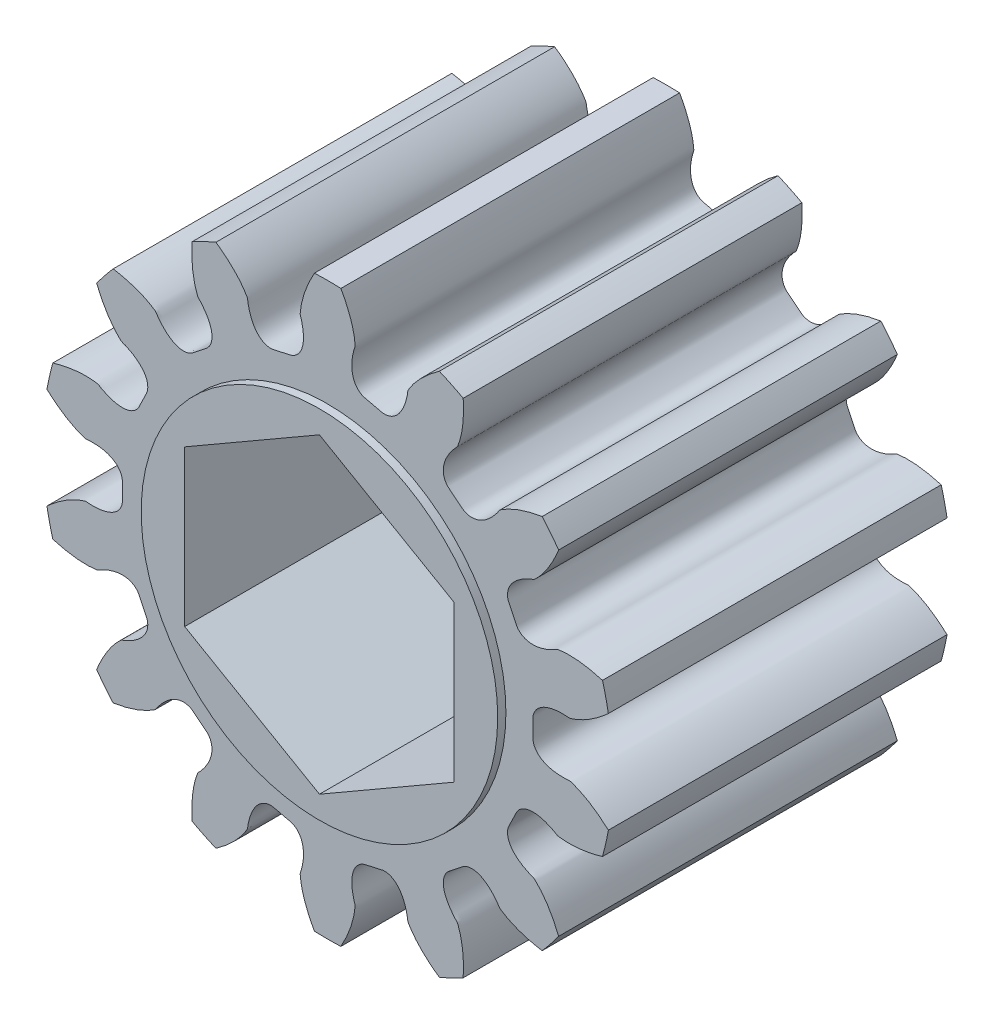
from build123d import *

# Parameters (mm, degrees)
BOSS_EXTRUDE1_DEPTH = 12.065
SKETCH2_R           = 6.35
BOSS_EXTRUDE2_DEPTH = 0.2921
BOSS_EXTRUDE3_START = 0.2921
SKETCH3_R           = 6.35
BOSS_EXTRUDE3_DEPTH = 0.2921
CUT_EXTRUDE1_DEPTH  = 20.058275239


with BuildPart() as part:
    # Sketch1 → Boss-Extrude1 (new body)
    with BuildSketch(Plane.XY.offset(6.0325)):
        with BuildLine():
            ThreePointArc((8.228776346, 5.959265042), (7.943407862, 6.334656387), (7.640928824, 6.69640252))
            add(Edge.make_bspline(
                [(4.82824311, 8.939444528), (4.833892588, 8.852687386), (4.83956114, 8.714236491), (4.839397518, 8.527056628), (4.834597301, 8.381215605), (4.825704165, 8.244427954), (4.813292608, 8.116797302), (4.797939964, 7.998399272), (4.780222678, 7.889283272), (4.760723014, 7.789466905), (4.740002099, 7.698954413), (4.718682579, 7.617677092), (4.697178715, 7.545684876), (4.676542333, 7.482543191), (4.650701206, 7.415927439), (4.621669261, 7.324730091), (4.540040809, 7.261231409), (4.481952223, 7.188233595), (4.43551344, 7.130936279), (4.39285588, 7.073433212), (4.35314075, 7.016307214), (4.316544651, 6.959436941), (4.282987183, 6.902864935), (4.252459951, 6.846571912), (4.224945594, 6.790531236), (4.200443436, 6.734690952), (4.178969629, 6.678974044), (4.160566483, 6.623273893), (4.145313008, 6.567451505), (4.133339922, 6.5113341), (4.12484958, 6.454717507), (4.120141721, 6.397375872), (4.119644468, 6.339084418), (4.123947256, 6.279663842), (4.133825193, 6.219056118), (4.150237388, 6.157442121), (4.174255479, 6.095387744), (4.206926479, 6.034019633), (4.248882322, 5.975011401), (4.295645816, 5.925851012), (4.399067692, 5.839116758), (4.564695196, 5.723946729), (4.713833258, 5.588099595), (4.821406436, 5.506570908), (4.879740128, 5.471919088), (4.946604954, 5.444145733), (5.01370442, 5.425949552), (5.079547492, 5.416342044), (5.143268754, 5.41405174), (5.204554963, 5.417907952), (5.263443202, 5.426935365), (5.320162519, 5.44039122), (5.375018882, 5.457740758), (5.4283267, 5.478616606), (5.480372862, 5.502776799), (5.531401448, 5.530069487), (5.581609996, 5.560405678), (5.631151593, 5.593739269), (5.680139601, 5.63005274), (5.7286527, 5.669347478), (5.776741391, 5.711635705), (5.82442778, 5.756940272), (5.871728798, 5.805273657), (5.918585081, 5.856704777), (5.965154226, 5.911088458), (6.010681377, 5.969112777), (6.068923056, 6.041988502), (6.112665655, 6.135700144), (6.195116279, 6.184297517), (6.254311643, 6.224314153), (6.311278208, 6.258483483), (6.376680368, 6.295467976), (6.451175858, 6.334338877), (6.534808176, 6.374681199), (6.627782855, 6.415903197), (6.730220622, 6.457456868), (6.842233881, 6.498770629), (6.963902735, 6.539271495), (7.095281925, 6.578379777), (7.23639826, 6.615512324), (7.418848724, 6.657323281), (7.555089737, 6.682605074), (7.640928824, 6.69640252)],
                knots=[0.010313213, 0.010313213, 0.010313213, 0.010313213, 0.046086444, 0.067310464, 0.087321683, 0.106120101, 0.123705718, 0.140078533, 0.155238548, 0.169185761, 0.181920174, 0.193441785, 0.203750595, 0.212846604, 0.220729812, 0.233281794, 0.251264484, 0.261666579, 0.271771633, 0.281588016, 0.291125391, 0.300394957, 0.309409753, 0.318185016, 0.32673863, 0.335091659, 0.343268986, 0.351300066, 0.359219801, 0.367069473, 0.374897695, 0.382761153, 0.390724829, 0.398861066, 0.407246569, 0.415956082, 0.425051594, 0.434566975, 0.44449066, 0.454752968, 0.462386324, 0.5, 0.537613676, 0.545247032, 0.55550934, 0.565433025, 0.574948406, 0.584043918, 0.592753431, 0.601138934, 0.609275171, 0.617238847, 0.625102305, 0.632930527, 0.640780199, 0.648699934, 0.656731014, 0.664908341, 0.67326137, 0.681814984, 0.690590247, 0.699605043, 0.708874609, 0.718411984, 0.728228367, 0.738333421, 0.748735516, 0.766718206, 0.779270188, 0.787153396, 0.796249405, 0.806558215, 0.818079826, 0.830814239, 0.844761452, 0.859921467, 0.876294282, 0.893879899, 0.912678317, 0.932689536, 0.953913556, 0.989686787, 0.989686787, 0.989686787, 0.989686787], degree=3))
            ThreePointArc((4.82824311, 8.939444528), (4.408258789, 9.153843698), (3.978778828, 9.348524966))
            add(Edge.make_bspline(
                [(0.471417111, 10.14905739), (0.514149629, 10.073343122), (0.579328409, 9.951062669), (0.66039529, 9.782348447), (0.719348491, 9.648867489), (0.770685991, 9.521767488), (0.814880429, 9.40139107), (0.852419155, 9.288056869), (0.883800089, 9.182059508), (0.909540197, 9.083667481), (0.930143197, 8.993128076), (0.946199881, 8.910649547), (0.958061821, 8.836456624), (0.966865234, 8.770614142), (0.972486674, 8.699383378), (0.985898842, 8.604620918), (0.939905194, 8.511993324), (0.919241751, 8.421020874), (0.902262226, 8.349248743), (0.888778739, 8.278931848), (0.877782684, 8.210231353), (0.869485825, 8.143114555), (0.863797265, 8.077584899), (0.860717807, 8.013621369), (0.860243365, 7.951192432), (0.862395875, 7.890250987), (0.867223304, 7.830734652), (0.874810032, 7.772565723), (0.885287552, 7.715653255), (0.898848604, 7.659898293), (0.91576409, 7.605204685), (0.936402058, 7.551498993), (0.961245763, 7.498764457), (0.990904063, 7.447095278), (1.026100482, 7.396775482), (1.06762067, 7.348384173), (1.116184607, 7.30289617), (1.172246787, 7.261780829), (1.235650407, 7.226820207), (1.299112753, 7.202818146), (1.429925226, 7.169546354), (1.629120853, 7.137644824), (1.822431467, 7.079959365), (1.954725523, 7.053178809), (2.022317225, 7.047268639), (2.094610758, 7.051257271), (2.162960315, 7.063976446), (2.226451415, 7.083888618), (2.284856014, 7.109472745), (2.338399833, 7.139538162), (2.387539455, 7.173222229), (2.432803517, 7.209955125), (2.47469971, 7.249387802), (2.513670703, 7.291325687), (2.55007996, 7.335675252), (2.584213274, 7.382405588), (2.616287232, 7.431522224), (2.646459766, 7.483050046), (2.674840612, 7.537022452), (2.701500055, 7.593474833), (2.726478295, 7.652440109), (2.749785332, 7.713948463), (2.771431007, 7.778018481), (2.791331932, 7.844686497), (2.809693087, 7.913890096), (2.825535825, 7.985921691), (2.846390172, 8.076850568), (2.845140934, 8.180261043), (2.89834077, 8.259819748), (2.934311383, 8.321557397), (2.970810967, 8.377059766), (3.013689307, 8.438758577), (3.063941972, 8.50610243), (3.12178821, 8.578736309), (3.187669946, 8.656216247), (3.261933723, 8.738100893), (3.344928813, 8.823924037), (3.436975996, 8.913204193), (3.538376109, 9.005442832), (3.649406325, 9.100126183), (3.795647418, 9.216958844), (3.90742697, 9.298849712), (3.978778828, 9.348524966)],
                knots=[0.010313213, 0.010313213, 0.010313213, 0.010313213, 0.046086444, 0.067310464, 0.087321683, 0.106120101, 0.123705718, 0.140078533, 0.155238548, 0.169185761, 0.181920174, 0.193441785, 0.203750595, 0.212846604, 0.220729812, 0.233281794, 0.251264484, 0.261666579, 0.271771633, 0.281588016, 0.291125391, 0.300394957, 0.309409753, 0.318185016, 0.32673863, 0.335091659, 0.343268986, 0.351300066, 0.359219801, 0.367069473, 0.374897695, 0.382761153, 0.390724829, 0.398861066, 0.407246569, 0.415956082, 0.425051594, 0.434566975, 0.44449066, 0.454752968, 0.462386324, 0.5, 0.537613676, 0.545247032, 0.55550934, 0.565433025, 0.574948406, 0.584043918, 0.592753431, 0.601138934, 0.609275171, 0.617238847, 0.625102305, 0.632930527, 0.640780199, 0.648699934, 0.656731014, 0.664908341, 0.67326137, 0.681814984, 0.690590247, 0.699605043, 0.708874609, 0.718411984, 0.728228367, 0.738333421, 0.748735516, 0.766718206, 0.779270188, 0.787153396, 0.796249405, 0.806558215, 0.818079826, 0.830814239, 0.844761452, 0.859921467, 0.876294282, 0.893879899, 0.912678317, 0.932689536, 0.953913556, 0.989686787, 0.989686787, 0.989686787, 0.989686787], degree=3))
            ThreePointArc((0.471417111, 10.14905739), (0, 10.16), (-0.471417111, 10.14905739))
            add(Edge.make_bspline(
                [(-3.978778828, 9.348524966), (-3.90742697, 9.298849712), (-3.795647418, 9.216958844), (-3.649406325, 9.100126183), (-3.538376109, 9.005442832), (-3.436975996, 8.913204193), (-3.344928813, 8.823924037), (-3.261933723, 8.738100893), (-3.187669946, 8.656216247), (-3.12178821, 8.578736309), (-3.063941972, 8.50610243), (-3.013689307, 8.438758577), (-2.970810967, 8.377059766), (-2.934311383, 8.321557397), (-2.89834077, 8.259819748), (-2.845140934, 8.180261043), (-2.846390172, 8.076850568), (-2.825535825, 7.985921691), (-2.809693087, 7.913890096), (-2.791331932, 7.844686497), (-2.771431007, 7.778018481), (-2.749785332, 7.713948463), (-2.726478295, 7.652440109), (-2.701500055, 7.593474833), (-2.674840612, 7.537022452), (-2.646459766, 7.483050046), (-2.616287232, 7.431522224), (-2.584213274, 7.382405588), (-2.55007996, 7.335675252), (-2.513670703, 7.291325687), (-2.47469971, 7.249387802), (-2.432803517, 7.209955125), (-2.387539455, 7.173222229), (-2.338399833, 7.139538162), (-2.284856014, 7.109472745), (-2.226451415, 7.083888618), (-2.162960315, 7.063976446), (-2.094610758, 7.051257271), (-2.022317225, 7.047268639), (-1.954725523, 7.053178809), (-1.822431467, 7.079959365), (-1.629120854, 7.137644824), (-1.429925226, 7.169546354), (-1.299112753, 7.202818146), (-1.235650407, 7.226820207), (-1.172246787, 7.261780829), (-1.116184607, 7.30289617), (-1.06762067, 7.348384173), (-1.026100482, 7.396775482), (-0.990904063, 7.447095278), (-0.961245763, 7.498764457), (-0.936402058, 7.551498993), (-0.91576409, 7.605204685), (-0.898848604, 7.659898293), (-0.885287552, 7.715653255), (-0.874810032, 7.772565723), (-0.867223304, 7.830734652), (-0.862395875, 7.890250987), (-0.860243365, 7.951192432), (-0.860717807, 8.013621369), (-0.863797265, 8.077584899), (-0.869485825, 8.143114555), (-0.877782684, 8.210231353), (-0.888778739, 8.278931848), (-0.902262226, 8.349248743), (-0.919241751, 8.421020874), (-0.939905194, 8.511993324), (-0.985898842, 8.604620918), (-0.972486674, 8.699383378), (-0.966865234, 8.770614142), (-0.958061821, 8.836456624), (-0.946199881, 8.910649547), (-0.930143197, 8.993128076), (-0.909540197, 9.083667481), (-0.883800089, 9.182059508), (-0.852419155, 9.288056869), (-0.814880429, 9.40139107), (-0.770685991, 9.521767488), (-0.719348492, 9.648867489), (-0.66039529, 9.782348447), (-0.579328409, 9.951062669), (-0.514149629, 10.073343122), (-0.471417111, 10.14905739)],
                knots=[0.010313213, 0.010313213, 0.010313213, 0.010313213, 0.046086444, 0.067310464, 0.087321683, 0.106120101, 0.123705718, 0.140078533, 0.155238548, 0.169185761, 0.181920174, 0.193441785, 0.203750595, 0.212846604, 0.220729812, 0.233281794, 0.251264484, 0.261666579, 0.271771633, 0.281588016, 0.291125391, 0.300394957, 0.309409753, 0.318185016, 0.32673863, 0.335091659, 0.343268986, 0.351300066, 0.359219801, 0.367069473, 0.374897695, 0.382761153, 0.390724829, 0.398861066, 0.407246569, 0.415956082, 0.425051594, 0.434566975, 0.44449066, 0.454752968, 0.462386324, 0.5, 0.537613676, 0.545247032, 0.55550934, 0.565433025, 0.574948406, 0.584043918, 0.592753431, 0.601138934, 0.609275171, 0.617238847, 0.625102305, 0.632930527, 0.640780199, 0.648699934, 0.656731014, 0.664908341, 0.67326137, 0.681814984, 0.690590247, 0.699605043, 0.708874609, 0.718411984, 0.728228367, 0.738333421, 0.748735516, 0.766718206, 0.779270188, 0.787153396, 0.796249405, 0.806558215, 0.818079826, 0.830814239, 0.844761452, 0.859921467, 0.876294282, 0.893879899, 0.912678317, 0.932689536, 0.953913556, 0.989686787, 0.989686787, 0.989686787, 0.989686787], degree=3))
            ThreePointArc((-3.978778828, 9.348524966), (-4.408258789, 9.153843698), (-4.82824311, 8.939444528))
            add(Edge.make_bspline(
                [(-7.640928824, 6.69640252), (-7.555089737, 6.682605074), (-7.418848724, 6.657323281), (-7.23639826, 6.615512324), (-7.095281925, 6.578379777), (-6.963902735, 6.539271495), (-6.842233881, 6.498770629), (-6.730220622, 6.457456868), (-6.627782855, 6.415903197), (-6.534808176, 6.374681199), (-6.451175858, 6.334338877), (-6.376680368, 6.295467976), (-6.311278208, 6.258483483), (-6.254311643, 6.224314153), (-6.195116279, 6.184297517), (-6.112665655, 6.135700144), (-6.068923056, 6.041988502), (-6.010681377, 5.969112777), (-5.965154226, 5.911088458), (-5.918585081, 5.856704777), (-5.871728798, 5.805273657), (-5.82442778, 5.756940272), (-5.776741391, 5.711635705), (-5.7286527, 5.669347478), (-5.680139601, 5.63005274), (-5.631151593, 5.59373927), (-5.581609996, 5.560405678), (-5.531401448, 5.530069487), (-5.480372862, 5.502776799), (-5.4283267, 5.478616606), (-5.375018882, 5.457740758), (-5.320162519, 5.44039122), (-5.263443202, 5.426935365), (-5.204554963, 5.417907952), (-5.143268754, 5.41405174), (-5.079547492, 5.416342044), (-5.01370442, 5.425949552), (-4.946604954, 5.444145733), (-4.879740128, 5.471919088), (-4.821406436, 5.506570908), (-4.713833258, 5.588099595), (-4.564695196, 5.723946729), (-4.399067692, 5.839116758), (-4.295645816, 5.925851012), (-4.248882322, 5.975011401), (-4.206926479, 6.034019633), (-4.174255479, 6.095387744), (-4.150237388, 6.157442121), (-4.133825193, 6.219056118), (-4.123947257, 6.279663842), (-4.119644468, 6.339084418), (-4.120141721, 6.397375872), (-4.12484958, 6.454717507), (-4.133339922, 6.5113341), (-4.145313008, 6.567451505), (-4.160566483, 6.623273893), (-4.178969629, 6.678974044), (-4.200443436, 6.734690952), (-4.224945594, 6.790531236), (-4.252459951, 6.846571912), (-4.282987183, 6.902864935), (-4.316544651, 6.959436941), (-4.35314075, 7.016307214), (-4.39285588, 7.073433212), (-4.43551344, 7.130936279), (-4.481952223, 7.188233595), (-4.540040809, 7.261231409), (-4.621669261, 7.324730091), (-4.650701206, 7.415927439), (-4.676542333, 7.482543191), (-4.697178715, 7.545684876), (-4.718682579, 7.617677092), (-4.740002099, 7.698954413), (-4.760723014, 7.789466905), (-4.780222678, 7.889283272), (-4.797939964, 7.998399272), (-4.813292608, 8.116797302), (-4.825704165, 8.244427954), (-4.834597301, 8.381215605), (-4.839397518, 8.527056628), (-4.83956114, 8.714236491), (-4.833892588, 8.852687386), (-4.82824311, 8.939444528)],
                knots=[0.010313213, 0.010313213, 0.010313213, 0.010313213, 0.046086444, 0.067310464, 0.087321683, 0.106120101, 0.123705718, 0.140078533, 0.155238548, 0.169185761, 0.181920174, 0.193441785, 0.203750595, 0.212846604, 0.220729812, 0.233281794, 0.251264484, 0.261666579, 0.271771633, 0.281588016, 0.291125391, 0.300394957, 0.309409753, 0.318185016, 0.32673863, 0.335091659, 0.343268986, 0.351300066, 0.359219801, 0.367069473, 0.374897695, 0.382761153, 0.390724829, 0.398861066, 0.407246569, 0.415956082, 0.425051594, 0.434566975, 0.44449066, 0.454752968, 0.462386324, 0.5, 0.537613676, 0.545247032, 0.55550934, 0.565433025, 0.574948406, 0.584043918, 0.592753431, 0.601138934, 0.609275171, 0.617238847, 0.625102305, 0.632930527, 0.640780199, 0.648699934, 0.656731014, 0.664908341, 0.67326137, 0.681814984, 0.690590247, 0.699605043, 0.708874609, 0.718411984, 0.728228367, 0.738333421, 0.748735516, 0.766718206, 0.779270188, 0.787153396, 0.796249405, 0.806558215, 0.818079826, 0.830814239, 0.844761452, 0.859921467, 0.876294282, 0.893879899, 0.912678317, 0.932689536, 0.953913556, 0.989686787, 0.989686787, 0.989686787, 0.989686787], degree=3))
            ThreePointArc((-7.640928824, 6.69640252), (-7.943407862, 6.334656387), (-8.228776346, 5.959265042))
            add(Edge.make_bspline(
                [(-9.789699156, 2.717975429), (-9.706374323, 2.742788544), (-9.572656053, 2.779123196), (-9.390132771, 2.820615114), (-9.246880138, 2.848387928), (-9.111543131, 2.870155878), (-8.984350614, 2.886455996), (-8.865504785, 2.897834316), (-8.755182084, 2.904841833), (-8.653529238, 2.908042297), (-8.560675246, 2.907981824), (-8.476691677, 2.905282734), (-8.401719397, 2.900337791), (-8.335568779, 2.894269154), (-8.264873031, 2.883899317), (-8.169501975, 2.875888583), (-8.089431298, 2.810436512), (-8.005337766, 2.77004787), (-7.939143412, 2.737523256), (-7.873589867, 2.708730847), (-7.809058689, 2.682723189), (-7.745470874, 2.659699456), (-7.682850007, 2.6395718), (-7.62117542, 2.622336326), (-7.56041728, 2.607982034), (-7.500524786, 2.596519828), (-7.441426445, 2.587982593), (-7.383027728, 2.582435302), (-7.325210706, 2.579985914), (-7.26783602, 2.580800315), (-7.210749644, 2.585121221), (-7.153798086, 2.593291112), (-7.096857471, 2.605777395), (-7.039884153, 2.623194626), (-6.98299404, 2.646311389), (-6.926576891, 2.6760225), (-6.871422875, 2.713246805), (-6.818863372, 2.758754365), (-6.770670653, 2.812788854), (-6.733148673, 2.869319105), (-6.671602561, 2.989448166), (-6.596175672, 3.176550785), (-6.49692085, 3.352178476), (-6.441373542, 3.475196409), (-6.420570983, 3.539778309), (-6.408372787, 3.611146847), (-6.405563859, 3.68061302), (-6.410848692, 3.746943141), (-6.422795126, 3.809576419), (-6.440192119, 3.868467967), (-6.462097062, 3.923870966), (-6.487836786, 3.976174002), (-6.516958024, 4.025794366), (-6.549172576, 4.073120332), (-6.584308384, 4.11848544), (-6.622271716, 4.162161438), (-6.663019767, 4.204360715), (-6.706541659, 4.245242779), (-6.752845532, 4.284922048), (-6.80195025, 4.32347492), (-6.853878962, 4.360947912), (-6.90865887, 4.397357489), (-6.966305902, 4.432717382), (-7.02687404, 4.466954379), (-7.090256819, 4.500254431), (-7.156957091, 4.531728495), (-7.240965662, 4.57229356), (-7.342061402, 4.594086638), (-7.407787327, 4.66365612), (-7.45997287, 4.712462794), (-7.505961757, 4.760397696), (-7.556572321, 4.815930264), (-7.611045453, 4.879908407), (-7.668986251, 4.952466877), (-7.729863539, 5.033937729), (-7.793169921, 5.124560606), (-7.858373155, 5.224572282), (-7.924932446, 5.334178353), (-7.992294822, 5.453561182), (-8.059897717, 5.582876666), (-8.141259434, 5.751448903), (-8.196223837, 5.878648341), (-8.228776346, 5.959265042)],
                knots=[0.010313213, 0.010313213, 0.010313213, 0.010313213, 0.046086444, 0.067310464, 0.087321683, 0.106120101, 0.123705718, 0.140078533, 0.155238548, 0.169185761, 0.181920174, 0.193441785, 0.203750595, 0.212846604, 0.220729812, 0.233281794, 0.251264484, 0.261666579, 0.271771633, 0.281588016, 0.291125391, 0.300394957, 0.309409753, 0.318185016, 0.32673863, 0.335091659, 0.343268986, 0.351300066, 0.359219801, 0.367069473, 0.374897695, 0.382761153, 0.390724829, 0.398861066, 0.407246569, 0.415956082, 0.425051594, 0.434566975, 0.44449066, 0.454752968, 0.462386324, 0.5, 0.537613676, 0.545247032, 0.55550934, 0.565433025, 0.574948406, 0.584043918, 0.592753431, 0.601138934, 0.609275171, 0.617238847, 0.625102305, 0.632930527, 0.640780199, 0.648699934, 0.656731014, 0.664908341, 0.67326137, 0.681814984, 0.690590247, 0.699605043, 0.708874609, 0.718411984, 0.728228367, 0.738333421, 0.748735516, 0.766718206, 0.779270188, 0.787153396, 0.796249405, 0.806558215, 0.818079826, 0.830814239, 0.844761452, 0.859921467, 0.876294282, 0.893879899, 0.912678317, 0.932689536, 0.953913556, 0.989686787, 0.989686787, 0.989686787, 0.989686787], degree=3))
            ThreePointArc((-9.789699156, 2.717975429), (-9.905267588, 2.260812689), (-9.999499508, 1.798780029))
            add(Edge.make_bspline(
                [(-9.999499508, -1.798780029), (-9.935192434, -1.740270896), (-9.830481451, -1.649516322), (-9.684036324, -1.532939511), (-9.567020335, -1.445762082), (-9.454530664, -1.36742931), (-9.347006522, -1.297556647), (-9.244866998, -1.235739863), (-9.148510127, -1.181559082), (-9.058312707, -1.134570046), (-8.974627912, -1.094336693), (-8.89779024, -1.060329384), (-8.828097019, -1.03225537), (-8.765864289, -1.009021346), (-8.697670317, -0.987690511), (-8.608268238, -0.953527983), (-8.507728461, -0.977756896), (-8.414438832, -0.977658989), (-8.340687878, -0.978242), (-8.269133617, -0.975740447), (-8.199708734, -0.971173509), (-8.13242847, -0.964327456), (-8.067275956, -0.955291671), (-8.00423088, -0.944060697), (-7.943261594, -0.930631498), (-7.884327057, -0.914972209), (-7.827377124, -0.897022183), (-7.772354818, -0.876681866), (-7.719200732, -0.853802823), (-7.667861282, -0.828175129), (-7.618303005, -0.799513277), (-7.570536207, -0.767442106), (-7.524652081, -0.731486746), (-7.480877949, -0.691074567), (-7.439651715, -0.645563388), (-7.401712789, -0.594316118), (-7.368171757, -0.536847748), (-7.340562272, -0.47304214), (-7.320586818, -0.40344871), (-7.31130824, -0.336236537), (-7.307979155, -0.201300135), (-7.32120266, 0), (-7.307979155, 0.201300135), (-7.31130824, 0.336236537), (-7.320586818, 0.40344871), (-7.340562272, 0.47304214), (-7.368171757, 0.536847748), (-7.401712789, 0.594316118), (-7.439651715, 0.645563388), (-7.480877949, 0.691074567), (-7.524652081, 0.731486746), (-7.570536207, 0.767442106), (-7.618303005, 0.799513277), (-7.667861282, 0.828175129), (-7.719200732, 0.853802823), (-7.772354818, 0.876681866), (-7.827377124, 0.897022183), (-7.884327057, 0.914972209), (-7.943261594, 0.930631498), (-8.00423088, 0.944060697), (-8.067275956, 0.955291671), (-8.13242847, 0.964327456), (-8.199708734, 0.971173509), (-8.269133617, 0.975740447), (-8.340687878, 0.978242), (-8.414438832, 0.977658989), (-8.507728461, 0.977756896), (-8.608268238, 0.953527983), (-8.697670317, 0.987690511), (-8.765864289, 1.009021346), (-8.828097019, 1.03225537), (-8.89779024, 1.060329384), (-8.974627912, 1.094336693), (-9.058312707, 1.134570046), (-9.148510127, 1.181559082), (-9.244866998, 1.235739863), (-9.347006522, 1.297556647), (-9.454530664, 1.36742931), (-9.567020335, 1.445762082), (-9.684036324, 1.532939511), (-9.830481451, 1.649516322), (-9.935192434, 1.740270896), (-9.999499508, 1.798780029)],
                knots=[0.010313213, 0.010313213, 0.010313213, 0.010313213, 0.046086444, 0.067310464, 0.087321683, 0.106120101, 0.123705718, 0.140078533, 0.155238548, 0.169185761, 0.181920174, 0.193441785, 0.203750595, 0.212846604, 0.220729812, 0.233281794, 0.251264484, 0.261666579, 0.271771633, 0.281588016, 0.291125391, 0.300394957, 0.309409753, 0.318185016, 0.32673863, 0.335091659, 0.343268986, 0.351300066, 0.359219801, 0.367069473, 0.374897695, 0.382761153, 0.390724829, 0.398861066, 0.407246569, 0.415956082, 0.425051594, 0.434566975, 0.44449066, 0.454752968, 0.462386324, 0.5, 0.537613676, 0.545247032, 0.55550934, 0.565433025, 0.574948406, 0.584043918, 0.592753431, 0.601138934, 0.609275171, 0.617238847, 0.625102305, 0.632930527, 0.640780199, 0.648699934, 0.656731014, 0.664908341, 0.67326137, 0.681814984, 0.690590247, 0.699605043, 0.708874609, 0.718411984, 0.728228367, 0.738333421, 0.748735516, 0.766718206, 0.779270188, 0.787153396, 0.796249405, 0.806558215, 0.818079826, 0.830814239, 0.844761452, 0.859921467, 0.876294282, 0.893879899, 0.912678317, 0.932689536, 0.953913556, 0.989686787, 0.989686787, 0.989686787, 0.989686787], degree=3))
            ThreePointArc((-9.999499508, -1.798780029), (-9.905267588, -2.260812689), (-9.789699156, -2.717975429))
            add(Edge.make_bspline(
                [(-8.228776346, -5.959265042), (-8.196223837, -5.878648341), (-8.141259434, -5.751448903), (-8.059897717, -5.582876666), (-7.992294822, -5.453561182), (-7.924932446, -5.334178353), (-7.858373155, -5.224572282), (-7.793169921, -5.124560606), (-7.729863539, -5.033937729), (-7.668986251, -4.952466877), (-7.611045453, -4.879908407), (-7.556572321, -4.815930264), (-7.505961757, -4.760397696), (-7.45997287, -4.712462794), (-7.407787327, -4.66365612), (-7.342061402, -4.594086638), (-7.240965662, -4.57229356), (-7.156957091, -4.531728495), (-7.090256819, -4.500254431), (-7.02687404, -4.466954379), (-6.966305902, -4.432717382), (-6.90865887, -4.397357489), (-6.853878962, -4.360947912), (-6.801950249, -4.32347492), (-6.752845532, -4.284922048), (-6.706541659, -4.245242779), (-6.663019767, -4.204360715), (-6.622271716, -4.162161438), (-6.584308383, -4.11848544), (-6.549172576, -4.073120332), (-6.516958024, -4.025794366), (-6.487836786, -3.976174002), (-6.462097062, -3.923870966), (-6.440192119, -3.868467967), (-6.422795126, -3.809576419), (-6.410848692, -3.746943141), (-6.405563859, -3.68061302), (-6.408372787, -3.611146847), (-6.420570983, -3.539778309), (-6.441373542, -3.475196409), (-6.49692085, -3.352178476), (-6.596175672, -3.176550785), (-6.671602561, -2.989448166), (-6.733148673, -2.869319105), (-6.770670653, -2.812788854), (-6.818863372, -2.758754365), (-6.871422875, -2.713246805), (-6.926576891, -2.6760225), (-6.98299404, -2.646311389), (-7.039884153, -2.623194626), (-7.096857471, -2.605777395), (-7.153798086, -2.593291112), (-7.210749644, -2.585121221), (-7.26783602, -2.580800315), (-7.325210706, -2.579985914), (-7.383027728, -2.582435302), (-7.441426445, -2.587982593), (-7.500524786, -2.596519828), (-7.56041728, -2.607982034), (-7.62117542, -2.622336326), (-7.682850007, -2.6395718), (-7.745470874, -2.659699456), (-7.809058689, -2.682723189), (-7.873589867, -2.708730847), (-7.939143412, -2.737523256), (-8.005337766, -2.77004787), (-8.089431298, -2.810436512), (-8.169501975, -2.875888583), (-8.264873031, -2.883899317), (-8.335568779, -2.894269154), (-8.401719397, -2.900337791), (-8.476691677, -2.905282734), (-8.560675246, -2.907981824), (-8.653529238, -2.908042297), (-8.755182084, -2.904841833), (-8.865504785, -2.897834316), (-8.984350614, -2.886455996), (-9.111543131, -2.870155878), (-9.246880138, -2.848387928), (-9.390132771, -2.820615114), (-9.572656053, -2.779123196), (-9.706374323, -2.742788544), (-9.789699156, -2.717975429)],
                knots=[0.010313213, 0.010313213, 0.010313213, 0.010313213, 0.046086444, 0.067310464, 0.087321683, 0.106120101, 0.123705718, 0.140078533, 0.155238548, 0.169185761, 0.181920174, 0.193441785, 0.203750595, 0.212846604, 0.220729812, 0.233281794, 0.251264484, 0.261666579, 0.271771633, 0.281588016, 0.291125391, 0.300394957, 0.309409753, 0.318185016, 0.32673863, 0.335091659, 0.343268986, 0.351300066, 0.359219801, 0.367069473, 0.374897695, 0.382761153, 0.390724829, 0.398861066, 0.407246569, 0.415956082, 0.425051594, 0.434566975, 0.44449066, 0.454752968, 0.462386324, 0.5, 0.537613676, 0.545247032, 0.55550934, 0.565433025, 0.574948406, 0.584043918, 0.592753431, 0.601138934, 0.609275171, 0.617238847, 0.625102305, 0.632930527, 0.640780199, 0.648699934, 0.656731014, 0.664908341, 0.67326137, 0.681814984, 0.690590247, 0.699605043, 0.708874609, 0.718411984, 0.728228367, 0.738333421, 0.748735516, 0.766718206, 0.779270188, 0.787153396, 0.796249405, 0.806558215, 0.818079826, 0.830814239, 0.844761452, 0.859921467, 0.876294282, 0.893879899, 0.912678317, 0.932689536, 0.953913556, 0.989686787, 0.989686787, 0.989686787, 0.989686787], degree=3))
            ThreePointArc((-8.228776346, -5.959265042), (-7.943407862, -6.334656387), (-7.640928824, -6.69640252))
            add(Edge.make_bspline(
                [(-4.82824311, -8.939444528), (-4.833892588, -8.852687386), (-4.83956114, -8.714236491), (-4.839397518, -8.527056628), (-4.834597301, -8.381215605), (-4.825704165, -8.244427954), (-4.813292608, -8.116797302), (-4.797939964, -7.998399272), (-4.780222678, -7.889283272), (-4.760723014, -7.789466905), (-4.740002099, -7.698954413), (-4.718682579, -7.617677092), (-4.697178715, -7.545684876), (-4.676542333, -7.482543191), (-4.650701206, -7.415927439), (-4.621669261, -7.324730091), (-4.540040809, -7.261231409), (-4.481952223, -7.188233595), (-4.43551344, -7.130936279), (-4.39285588, -7.073433212), (-4.35314075, -7.016307214), (-4.316544651, -6.959436941), (-4.282987183, -6.902864935), (-4.252459951, -6.846571912), (-4.224945594, -6.790531236), (-4.200443436, -6.734690952), (-4.178969629, -6.678974044), (-4.160566483, -6.623273893), (-4.145313008, -6.567451505), (-4.133339922, -6.5113341), (-4.12484958, -6.454717507), (-4.120141721, -6.397375872), (-4.119644468, -6.339084418), (-4.123947257, -6.279663842), (-4.133825193, -6.219056118), (-4.150237388, -6.157442121), (-4.174255479, -6.095387744), (-4.206926479, -6.034019633), (-4.248882322, -5.975011401), (-4.295645816, -5.925851012), (-4.399067692, -5.839116758), (-4.564695196, -5.723946729), (-4.713833258, -5.588099595), (-4.821406436, -5.506570908), (-4.879740128, -5.471919088), (-4.946604954, -5.444145733), (-5.01370442, -5.425949552), (-5.079547492, -5.416342044), (-5.143268754, -5.41405174), (-5.204554963, -5.417907952), (-5.263443202, -5.426935365), (-5.320162519, -5.44039122), (-5.375018882, -5.457740758), (-5.4283267, -5.478616606), (-5.480372862, -5.502776799), (-5.531401448, -5.530069487), (-5.581609996, -5.560405678), (-5.631151593, -5.59373927), (-5.680139601, -5.63005274), (-5.7286527, -5.669347478), (-5.776741391, -5.711635705), (-5.82442778, -5.756940272), (-5.871728798, -5.805273657), (-5.918585081, -5.856704777), (-5.965154226, -5.911088458), (-6.010681377, -5.969112777), (-6.068923056, -6.041988502), (-6.112665655, -6.135700144), (-6.195116279, -6.184297517), (-6.254311643, -6.224314153), (-6.311278208, -6.258483483), (-6.376680368, -6.295467976), (-6.451175858, -6.334338877), (-6.534808176, -6.374681199), (-6.627782855, -6.415903197), (-6.730220622, -6.457456868), (-6.842233881, -6.498770629), (-6.963902735, -6.539271495), (-7.095281925, -6.578379777), (-7.23639826, -6.615512324), (-7.418848724, -6.657323281), (-7.555089737, -6.682605074), (-7.640928824, -6.69640252)],
                knots=[0.010313213, 0.010313213, 0.010313213, 0.010313213, 0.046086444, 0.067310464, 0.087321683, 0.106120101, 0.123705718, 0.140078533, 0.155238548, 0.169185761, 0.181920174, 0.193441785, 0.203750595, 0.212846604, 0.220729812, 0.233281794, 0.251264484, 0.261666579, 0.271771633, 0.281588016, 0.291125391, 0.300394957, 0.309409753, 0.318185016, 0.32673863, 0.335091659, 0.343268986, 0.351300066, 0.359219801, 0.367069473, 0.374897695, 0.382761153, 0.390724829, 0.398861066, 0.407246569, 0.415956082, 0.425051594, 0.434566975, 0.44449066, 0.454752968, 0.462386324, 0.5, 0.537613676, 0.545247032, 0.55550934, 0.565433025, 0.574948406, 0.584043918, 0.592753431, 0.601138934, 0.609275171, 0.617238847, 0.625102305, 0.632930527, 0.640780199, 0.648699934, 0.656731014, 0.664908341, 0.67326137, 0.681814984, 0.690590247, 0.699605043, 0.708874609, 0.718411984, 0.728228367, 0.738333421, 0.748735516, 0.766718206, 0.779270188, 0.787153396, 0.796249405, 0.806558215, 0.818079826, 0.830814239, 0.844761452, 0.859921467, 0.876294282, 0.893879899, 0.912678317, 0.932689536, 0.953913556, 0.989686787, 0.989686787, 0.989686787, 0.989686787], degree=3))
            ThreePointArc((-4.82824311, -8.939444528), (-4.408258789, -9.153843698), (-3.978778828, -9.348524966))
            add(Edge.make_bspline(
                [(-0.471417111, -10.14905739), (-0.514149629, -10.073343122), (-0.579328409, -9.951062669), (-0.66039529, -9.782348447), (-0.719348492, -9.648867489), (-0.770685991, -9.521767488), (-0.814880429, -9.40139107), (-0.852419155, -9.288056869), (-0.883800089, -9.182059508), (-0.909540197, -9.083667481), (-0.930143197, -8.993128076), (-0.946199881, -8.910649547), (-0.958061821, -8.836456624), (-0.966865234, -8.770614142), (-0.972486674, -8.699383378), (-0.985898842, -8.604620918), (-0.939905194, -8.511993324), (-0.919241751, -8.421020874), (-0.902262226, -8.349248743), (-0.888778739, -8.278931848), (-0.877782684, -8.210231353), (-0.869485825, -8.143114555), (-0.863797265, -8.077584899), (-0.860717807, -8.013621369), (-0.860243365, -7.951192432), (-0.862395875, -7.890250987), (-0.867223304, -7.830734652), (-0.874810032, -7.772565723), (-0.885287552, -7.715653255), (-0.898848604, -7.659898293), (-0.91576409, -7.605204685), (-0.936402058, -7.551498993), (-0.961245763, -7.498764457), (-0.990904063, -7.447095278), (-1.026100482, -7.396775482), (-1.06762067, -7.348384173), (-1.116184607, -7.30289617), (-1.172246787, -7.261780829), (-1.235650407, -7.226820207), (-1.299112753, -7.202818146), (-1.429925226, -7.169546354), (-1.629120854, -7.137644824), (-1.822431467, -7.079959365), (-1.954725523, -7.053178809), (-2.022317225, -7.047268639), (-2.094610758, -7.051257271), (-2.162960315, -7.063976446), (-2.226451415, -7.083888618), (-2.284856014, -7.109472746), (-2.338399833, -7.139538162), (-2.387539455, -7.173222229), (-2.432803517, -7.209955125), (-2.47469971, -7.249387802), (-2.513670703, -7.291325687), (-2.55007996, -7.335675252), (-2.584213274, -7.382405588), (-2.616287232, -7.431522224), (-2.646459766, -7.483050046), (-2.674840612, -7.537022452), (-2.701500055, -7.593474833), (-2.726478295, -7.652440109), (-2.749785332, -7.713948463), (-2.771431007, -7.778018481), (-2.791331932, -7.844686497), (-2.809693087, -7.913890096), (-2.825535825, -7.985921691), (-2.846390172, -8.076850568), (-2.845140934, -8.180261043), (-2.89834077, -8.259819748), (-2.934311383, -8.321557397), (-2.970810967, -8.377059766), (-3.013689307, -8.438758577), (-3.063941972, -8.50610243), (-3.12178821, -8.578736309), (-3.187669946, -8.656216247), (-3.261933723, -8.738100893), (-3.344928813, -8.823924037), (-3.436975996, -8.913204193), (-3.538376109, -9.005442832), (-3.649406325, -9.100126183), (-3.795647418, -9.216958844), (-3.90742697, -9.298849712), (-3.978778828, -9.348524966)],
                knots=[0.010313213, 0.010313213, 0.010313213, 0.010313213, 0.046086444, 0.067310464, 0.087321683, 0.106120101, 0.123705718, 0.140078533, 0.155238548, 0.169185761, 0.181920174, 0.193441785, 0.203750595, 0.212846604, 0.220729812, 0.233281794, 0.251264484, 0.261666579, 0.271771633, 0.281588016, 0.291125391, 0.300394957, 0.309409753, 0.318185016, 0.32673863, 0.335091659, 0.343268986, 0.351300066, 0.359219801, 0.367069473, 0.374897695, 0.382761153, 0.390724829, 0.398861066, 0.407246569, 0.415956082, 0.425051594, 0.434566975, 0.44449066, 0.454752968, 0.462386324, 0.5, 0.537613676, 0.545247032, 0.55550934, 0.565433025, 0.574948406, 0.584043918, 0.592753431, 0.601138934, 0.609275171, 0.617238847, 0.625102305, 0.632930527, 0.640780199, 0.648699934, 0.656731014, 0.664908341, 0.67326137, 0.681814984, 0.690590247, 0.699605043, 0.708874609, 0.718411984, 0.728228367, 0.738333421, 0.748735516, 0.766718206, 0.779270188, 0.787153396, 0.796249405, 0.806558215, 0.818079826, 0.830814239, 0.844761452, 0.859921467, 0.876294282, 0.893879899, 0.912678317, 0.932689536, 0.953913556, 0.989686787, 0.989686787, 0.989686787, 0.989686787], degree=3))
            ThreePointArc((-0.471417111, -10.14905739), (0, -10.16), (0.471417111, -10.14905739))
            add(Edge.make_bspline(
                [(3.978778828, -9.348524966), (3.90742697, -9.298849712), (3.795647418, -9.216958844), (3.649406325, -9.100126183), (3.538376109, -9.005442832), (3.436975996, -8.913204193), (3.344928813, -8.823924037), (3.261933723, -8.738100893), (3.187669946, -8.656216247), (3.12178821, -8.578736309), (3.063941972, -8.50610243), (3.013689307, -8.438758577), (2.970810967, -8.377059766), (2.934311383, -8.321557397), (2.89834077, -8.259819748), (2.845140934, -8.180261043), (2.846390172, -8.076850568), (2.825535825, -7.985921691), (2.809693087, -7.913890096), (2.791331932, -7.844686497), (2.771431007, -7.778018481), (2.749785332, -7.713948463), (2.726478295, -7.652440109), (2.701500055, -7.593474833), (2.674840612, -7.537022452), (2.646459766, -7.483050046), (2.616287232, -7.431522224), (2.584213274, -7.382405588), (2.55007996, -7.335675252), (2.513670703, -7.291325687), (2.47469971, -7.249387802), (2.432803517, -7.209955124), (2.387539455, -7.173222229), (2.338399833, -7.139538162), (2.284856014, -7.109472745), (2.226451415, -7.083888618), (2.162960315, -7.063976446), (2.094610758, -7.051257271), (2.022317225, -7.047268639), (1.954725523, -7.053178809), (1.822431467, -7.079959365), (1.629120854, -7.137644824), (1.429925226, -7.169546354), (1.299112753, -7.202818146), (1.235650407, -7.226820207), (1.172246787, -7.261780829), (1.116184607, -7.30289617), (1.06762067, -7.348384173), (1.026100482, -7.396775482), (0.990904063, -7.447095278), (0.961245763, -7.498764457), (0.936402058, -7.551498993), (0.91576409, -7.605204685), (0.898848604, -7.659898293), (0.885287552, -7.715653255), (0.874810032, -7.772565723), (0.867223304, -7.830734652), (0.862395875, -7.890250987), (0.860243365, -7.951192432), (0.860717807, -8.013621369), (0.863797265, -8.077584899), (0.869485825, -8.143114555), (0.877782684, -8.210231353), (0.888778739, -8.278931848), (0.902262226, -8.349248743), (0.919241751, -8.421020874), (0.939905194, -8.511993324), (0.985898842, -8.604620918), (0.972486674, -8.699383378), (0.966865234, -8.770614142), (0.958061821, -8.836456624), (0.946199881, -8.910649547), (0.930143197, -8.993128076), (0.909540197, -9.083667481), (0.883800089, -9.182059508), (0.852419155, -9.288056869), (0.814880429, -9.40139107), (0.770685991, -9.521767488), (0.719348492, -9.648867489), (0.66039529, -9.782348447), (0.579328409, -9.951062669), (0.514149629, -10.073343122), (0.471417111, -10.14905739)],
                knots=[0.010313213, 0.010313213, 0.010313213, 0.010313213, 0.046086444, 0.067310464, 0.087321683, 0.106120101, 0.123705718, 0.140078533, 0.155238548, 0.169185761, 0.181920174, 0.193441785, 0.203750595, 0.212846604, 0.220729812, 0.233281794, 0.251264484, 0.261666579, 0.271771633, 0.281588016, 0.291125391, 0.300394957, 0.309409753, 0.318185016, 0.32673863, 0.335091659, 0.343268986, 0.351300066, 0.359219801, 0.367069473, 0.374897695, 0.382761153, 0.390724829, 0.398861066, 0.407246569, 0.415956082, 0.425051594, 0.434566975, 0.44449066, 0.454752968, 0.462386324, 0.5, 0.537613676, 0.545247032, 0.55550934, 0.565433025, 0.574948406, 0.584043918, 0.592753431, 0.601138934, 0.609275171, 0.617238847, 0.625102305, 0.632930527, 0.640780199, 0.648699934, 0.656731014, 0.664908341, 0.67326137, 0.681814984, 0.690590247, 0.699605043, 0.708874609, 0.718411984, 0.728228367, 0.738333421, 0.748735516, 0.766718206, 0.779270188, 0.787153396, 0.796249405, 0.806558215, 0.818079826, 0.830814239, 0.844761452, 0.859921467, 0.876294282, 0.893879899, 0.912678317, 0.932689536, 0.953913556, 0.989686787, 0.989686787, 0.989686787, 0.989686787], degree=3))
            ThreePointArc((3.978778828, -9.348524966), (4.408258789, -9.153843698), (4.82824311, -8.939444528))
            add(Edge.make_bspline(
                [(7.640928824, -6.69640252), (7.555089737, -6.682605074), (7.418848724, -6.657323281), (7.23639826, -6.615512324), (7.095281925, -6.578379777), (6.963902735, -6.539271495), (6.842233881, -6.498770629), (6.730220622, -6.457456868), (6.627782855, -6.415903197), (6.534808176, -6.374681199), (6.451175858, -6.334338877), (6.376680368, -6.295467976), (6.311278208, -6.258483483), (6.254311643, -6.224314153), (6.195116279, -6.184297517), (6.112665655, -6.135700144), (6.068923056, -6.041988502), (6.010681377, -5.969112777), (5.965154226, -5.911088458), (5.918585081, -5.856704777), (5.871728798, -5.805273657), (5.82442778, -5.756940272), (5.776741391, -5.711635705), (5.7286527, -5.669347478), (5.680139601, -5.63005274), (5.631151593, -5.593739269), (5.581609996, -5.560405678), (5.531401448, -5.530069487), (5.480372862, -5.502776799), (5.4283267, -5.478616606), (5.375018882, -5.457740758), (5.320162519, -5.44039122), (5.263443202, -5.426935365), (5.204554963, -5.417907952), (5.143268754, -5.41405174), (5.079547492, -5.416342044), (5.01370442, -5.425949552), (4.946604954, -5.444145733), (4.879740128, -5.471919088), (4.821406436, -5.506570908), (4.713833258, -5.588099595), (4.564695196, -5.723946729), (4.399067692, -5.839116758), (4.295645816, -5.925851012), (4.248882322, -5.975011401), (4.206926479, -6.034019633), (4.174255479, -6.095387744), (4.150237388, -6.157442121), (4.133825193, -6.219056118), (4.123947257, -6.279663842), (4.119644468, -6.339084418), (4.120141721, -6.397375872), (4.12484958, -6.454717507), (4.133339922, -6.5113341), (4.145313008, -6.567451505), (4.160566483, -6.623273893), (4.178969629, -6.678974044), (4.200443436, -6.734690952), (4.224945594, -6.790531236), (4.252459951, -6.846571912), (4.282987183, -6.902864935), (4.316544651, -6.959436941), (4.35314075, -7.016307214), (4.39285588, -7.073433212), (4.43551344, -7.130936279), (4.481952223, -7.188233595), (4.540040809, -7.261231409), (4.621669261, -7.324730091), (4.650701206, -7.415927439), (4.676542333, -7.482543191), (4.697178715, -7.545684876), (4.718682579, -7.617677092), (4.740002099, -7.698954413), (4.760723014, -7.789466905), (4.780222678, -7.889283272), (4.797939964, -7.998399272), (4.813292608, -8.116797302), (4.825704165, -8.244427954), (4.834597301, -8.381215605), (4.839397518, -8.527056628), (4.83956114, -8.714236491), (4.833892588, -8.852687386), (4.82824311, -8.939444528)],
                knots=[0.010313213, 0.010313213, 0.010313213, 0.010313213, 0.046086444, 0.067310464, 0.087321683, 0.106120101, 0.123705718, 0.140078533, 0.155238548, 0.169185761, 0.181920174, 0.193441785, 0.203750595, 0.212846604, 0.220729812, 0.233281794, 0.251264484, 0.261666579, 0.271771633, 0.281588016, 0.291125391, 0.300394957, 0.309409753, 0.318185016, 0.32673863, 0.335091659, 0.343268986, 0.351300066, 0.359219801, 0.367069473, 0.374897695, 0.382761153, 0.390724829, 0.398861066, 0.407246569, 0.415956082, 0.425051594, 0.434566975, 0.44449066, 0.454752968, 0.462386324, 0.5, 0.537613676, 0.545247032, 0.55550934, 0.565433025, 0.574948406, 0.584043918, 0.592753431, 0.601138934, 0.609275171, 0.617238847, 0.625102305, 0.632930527, 0.640780199, 0.648699934, 0.656731014, 0.664908341, 0.67326137, 0.681814984, 0.690590247, 0.699605043, 0.708874609, 0.718411984, 0.728228367, 0.738333421, 0.748735516, 0.766718206, 0.779270188, 0.787153396, 0.796249405, 0.806558215, 0.818079826, 0.830814239, 0.844761452, 0.859921467, 0.876294282, 0.893879899, 0.912678317, 0.932689536, 0.953913556, 0.989686787, 0.989686787, 0.989686787, 0.989686787], degree=3))
            ThreePointArc((7.640928824, -6.69640252), (7.943407862, -6.334656387), (8.228776346, -5.959265042))
            add(Edge.make_bspline(
                [(9.789699156, -2.717975429), (9.706374323, -2.742788544), (9.572656053, -2.779123196), (9.390132771, -2.820615114), (9.246880138, -2.848387928), (9.111543131, -2.870155878), (8.984350614, -2.886455996), (8.865504785, -2.897834316), (8.755182084, -2.904841833), (8.653529238, -2.908042297), (8.560675246, -2.907981824), (8.476691677, -2.905282734), (8.401719397, -2.900337791), (8.335568779, -2.894269154), (8.264873031, -2.883899317), (8.169501975, -2.875888583), (8.089431298, -2.810436512), (8.005337766, -2.77004787), (7.939143412, -2.737523256), (7.873589867, -2.708730847), (7.809058689, -2.682723189), (7.745470874, -2.659699456), (7.682850007, -2.6395718), (7.62117542, -2.622336326), (7.56041728, -2.607982034), (7.500524786, -2.596519828), (7.441426445, -2.587982593), (7.383027728, -2.582435302), (7.325210706, -2.579985914), (7.26783602, -2.580800315), (7.210749644, -2.585121221), (7.153798086, -2.593291112), (7.096857471, -2.605777395), (7.039884153, -2.623194626), (6.98299404, -2.646311389), (6.926576891, -2.6760225), (6.871422875, -2.713246805), (6.818863372, -2.758754365), (6.770670653, -2.812788854), (6.733148673, -2.869319105), (6.671602561, -2.989448166), (6.596175672, -3.176550785), (6.49692085, -3.352178476), (6.441373542, -3.475196409), (6.420570983, -3.539778309), (6.408372787, -3.611146847), (6.405563859, -3.68061302), (6.410848692, -3.746943141), (6.422795126, -3.809576419), (6.440192119, -3.868467967), (6.462097062, -3.923870966), (6.487836786, -3.976174002), (6.516958024, -4.025794366), (6.549172576, -4.073120332), (6.584308383, -4.11848544), (6.622271716, -4.162161438), (6.663019767, -4.204360715), (6.706541659, -4.245242779), (6.752845532, -4.284922048), (6.801950249, -4.32347492), (6.853878962, -4.360947912), (6.90865887, -4.397357489), (6.966305902, -4.432717382), (7.02687404, -4.466954379), (7.090256819, -4.500254431), (7.156957091, -4.531728495), (7.240965662, -4.57229356), (7.342061402, -4.594086638), (7.407787327, -4.66365612), (7.45997287, -4.712462794), (7.505961757, -4.760397696), (7.556572321, -4.815930264), (7.611045453, -4.879908407), (7.668986251, -4.952466877), (7.729863539, -5.033937729), (7.793169921, -5.124560606), (7.858373155, -5.224572282), (7.924932446, -5.334178353), (7.992294822, -5.453561182), (8.059897717, -5.582876666), (8.141259434, -5.751448903), (8.196223837, -5.878648341), (8.228776346, -5.959265042)],
                knots=[0.010313213, 0.010313213, 0.010313213, 0.010313213, 0.046086444, 0.067310464, 0.087321683, 0.106120101, 0.123705718, 0.140078533, 0.155238548, 0.169185761, 0.181920174, 0.193441785, 0.203750595, 0.212846604, 0.220729812, 0.233281794, 0.251264484, 0.261666579, 0.271771633, 0.281588016, 0.291125391, 0.300394957, 0.309409753, 0.318185016, 0.32673863, 0.335091659, 0.343268986, 0.351300066, 0.359219801, 0.367069473, 0.374897695, 0.382761153, 0.390724829, 0.398861066, 0.407246569, 0.415956082, 0.425051594, 0.434566975, 0.44449066, 0.454752968, 0.462386324, 0.5, 0.537613676, 0.545247032, 0.55550934, 0.565433025, 0.574948406, 0.584043918, 0.592753431, 0.601138934, 0.609275171, 0.617238847, 0.625102305, 0.632930527, 0.640780199, 0.648699934, 0.656731014, 0.664908341, 0.67326137, 0.681814984, 0.690590247, 0.699605043, 0.708874609, 0.718411984, 0.728228367, 0.738333421, 0.748735516, 0.766718206, 0.779270188, 0.787153396, 0.796249405, 0.806558215, 0.818079826, 0.830814239, 0.844761452, 0.859921467, 0.876294282, 0.893879899, 0.912678317, 0.932689536, 0.953913556, 0.989686787, 0.989686787, 0.989686787, 0.989686787], degree=3))
            ThreePointArc((9.789699156, -2.717975429), (9.905267588, -2.260812689), (9.999499508, -1.798780029))
            add(Edge.make_bspline(
                [(9.999499508, 1.798780029), (9.935192434, 1.740270896), (9.830481451, 1.649516323), (9.684036324, 1.532939511), (9.567020334, 1.445762082), (9.454530664, 1.36742931), (9.347006522, 1.297556647), (9.244866998, 1.235739863), (9.148510127, 1.181559082), (9.058312707, 1.134570046), (8.974627912, 1.094336693), (8.89779024, 1.060329384), (8.828097019, 1.03225537), (8.765864289, 1.009021346), (8.697670317, 0.987690511), (8.608268238, 0.953527983), (8.507728461, 0.977756896), (8.414438832, 0.977658989), (8.340687878, 0.978242), (8.269133617, 0.975740447), (8.199708734, 0.971173509), (8.13242847, 0.964327456), (8.067275956, 0.955291671), (8.00423088, 0.944060697), (7.943261594, 0.930631498), (7.884327057, 0.914972209), (7.827377124, 0.897022183), (7.772354818, 0.876681866), (7.719200732, 0.853802823), (7.667861281, 0.828175129), (7.618303005, 0.799513277), (7.570536207, 0.767442106), (7.524652081, 0.731486746), (7.480877948, 0.691074567), (7.439651715, 0.645563388), (7.401712789, 0.594316118), (7.368171757, 0.536847748), (7.340562272, 0.47304214), (7.320586818, 0.40344871), (7.31130824, 0.336236537), (7.307979155, 0.201300135), (7.32120266, 0), (7.307979155, -0.201300135), (7.31130824, -0.336236537), (7.320586818, -0.40344871), (7.340562272, -0.47304214), (7.368171757, -0.536847748), (7.401712789, -0.594316118), (7.439651715, -0.645563388), (7.480877948, -0.691074567), (7.524652081, -0.731486746), (7.570536207, -0.767442106), (7.618303005, -0.799513277), (7.667861281, -0.828175129), (7.719200732, -0.853802823), (7.772354818, -0.876681866), (7.827377124, -0.897022183), (7.884327057, -0.914972209), (7.943261594, -0.930631498), (8.00423088, -0.944060697), (8.067275956, -0.955291671), (8.13242847, -0.964327456), (8.199708734, -0.971173509), (8.269133617, -0.975740447), (8.340687878, -0.978242), (8.414438832, -0.977658989), (8.507728461, -0.977756896), (8.608268238, -0.953527983), (8.697670317, -0.987690511), (8.765864289, -1.009021346), (8.828097019, -1.03225537), (8.89779024, -1.060329384), (8.974627912, -1.094336693), (9.058312707, -1.134570046), (9.148510127, -1.181559082), (9.244866998, -1.235739862), (9.347006522, -1.297556647), (9.454530664, -1.36742931), (9.567020334, -1.445762082), (9.684036324, -1.532939511), (9.830481451, -1.649516322), (9.935192434, -1.740270896), (9.999499508, -1.798780029)],
                knots=[0.010313213, 0.010313213, 0.010313213, 0.010313213, 0.046086444, 0.067310464, 0.087321683, 0.106120101, 0.123705718, 0.140078533, 0.155238548, 0.169185761, 0.181920174, 0.193441785, 0.203750595, 0.212846604, 0.220729812, 0.233281794, 0.251264484, 0.261666579, 0.271771633, 0.281588016, 0.291125391, 0.300394957, 0.309409753, 0.318185016, 0.32673863, 0.335091659, 0.343268986, 0.351300066, 0.359219801, 0.367069473, 0.374897695, 0.382761153, 0.390724829, 0.398861066, 0.407246569, 0.415956082, 0.425051594, 0.434566975, 0.44449066, 0.454752968, 0.462386324, 0.5, 0.537613676, 0.545247032, 0.55550934, 0.565433025, 0.574948406, 0.584043918, 0.592753431, 0.601138934, 0.609275171, 0.617238847, 0.625102305, 0.632930527, 0.640780199, 0.648699934, 0.656731014, 0.664908341, 0.67326137, 0.681814984, 0.690590247, 0.699605043, 0.708874609, 0.718411984, 0.728228367, 0.738333421, 0.748735516, 0.766718206, 0.779270188, 0.787153396, 0.796249405, 0.806558215, 0.818079826, 0.830814239, 0.844761452, 0.859921467, 0.876294282, 0.893879899, 0.912678317, 0.932689536, 0.953913556, 0.989686787, 0.989686787, 0.989686787, 0.989686787], degree=3))
            ThreePointArc((9.999499508, 1.798780029), (9.905267588, 2.260812689), (9.789699156, 2.717975429))
            add(Edge.make_bspline(
                [(8.228776346, 5.959265042), (8.196223837, 5.878648341), (8.141259434, 5.751448903), (8.059897717, 5.582876666), (7.992294822, 5.453561182), (7.924932446, 5.334178353), (7.858373155, 5.224572282), (7.793169921, 5.124560606), (7.729863539, 5.033937729), (7.668986251, 4.952466877), (7.611045453, 4.879908407), (7.556572321, 4.815930264), (7.505961757, 4.760397696), (7.45997287, 4.712462794), (7.407787327, 4.66365612), (7.342061402, 4.594086638), (7.240965662, 4.57229356), (7.156957091, 4.531728495), (7.090256819, 4.500254431), (7.02687404, 4.466954379), (6.966305902, 4.432717382), (6.90865887, 4.397357489), (6.853878962, 4.360947912), (6.801950249, 4.32347492), (6.752845532, 4.284922048), (6.706541659, 4.245242779), (6.663019767, 4.204360715), (6.622271716, 4.162161438), (6.584308383, 4.11848544), (6.549172576, 4.073120332), (6.516958024, 4.025794366), (6.487836786, 3.976174002), (6.462097062, 3.923870966), (6.440192119, 3.868467967), (6.422795126, 3.809576419), (6.410848692, 3.746943141), (6.405563859, 3.68061302), (6.408372787, 3.611146847), (6.420570983, 3.539778309), (6.441373542, 3.475196409), (6.49692085, 3.352178476), (6.596175672, 3.176550785), (6.671602561, 2.989448166), (6.733148673, 2.869319105), (6.770670653, 2.812788854), (6.818863372, 2.758754365), (6.871422875, 2.713246805), (6.926576891, 2.6760225), (6.98299404, 2.646311389), (7.039884153, 2.623194626), (7.096857471, 2.605777395), (7.153798086, 2.593291112), (7.210749644, 2.585121221), (7.26783602, 2.580800315), (7.325210706, 2.579985914), (7.383027728, 2.582435302), (7.441426445, 2.587982593), (7.500524786, 2.596519828), (7.56041728, 2.607982034), (7.62117542, 2.622336326), (7.682850007, 2.6395718), (7.745470874, 2.659699456), (7.809058689, 2.682723189), (7.873589867, 2.708730847), (7.939143412, 2.737523256), (8.005337766, 2.77004787), (8.089431298, 2.810436512), (8.169501975, 2.875888583), (8.264873031, 2.883899317), (8.335568779, 2.894269154), (8.401719397, 2.900337791), (8.476691677, 2.905282734), (8.560675246, 2.907981824), (8.653529238, 2.908042297), (8.755182084, 2.904841833), (8.865504785, 2.897834316), (8.984350614, 2.886455996), (9.111543131, 2.870155878), (9.246880138, 2.848387928), (9.390132771, 2.820615114), (9.572656053, 2.779123196), (9.706374323, 2.742788544), (9.789699156, 2.717975429)],
                knots=[0.010313213, 0.010313213, 0.010313213, 0.010313213, 0.046086444, 0.067310464, 0.087321683, 0.106120101, 0.123705718, 0.140078533, 0.155238548, 0.169185761, 0.181920174, 0.193441785, 0.203750595, 0.212846604, 0.220729812, 0.233281794, 0.251264484, 0.261666579, 0.271771633, 0.281588016, 0.291125391, 0.300394957, 0.309409753, 0.318185016, 0.32673863, 0.335091659, 0.343268986, 0.351300066, 0.359219801, 0.367069473, 0.374897695, 0.382761153, 0.390724829, 0.398861066, 0.407246569, 0.415956082, 0.425051594, 0.434566975, 0.44449066, 0.454752968, 0.462386324, 0.5, 0.537613676, 0.545247032, 0.55550934, 0.565433025, 0.574948406, 0.584043918, 0.592753431, 0.601138934, 0.609275171, 0.617238847, 0.625102305, 0.632930527, 0.640780199, 0.648699934, 0.656731014, 0.664908341, 0.67326137, 0.681814984, 0.690590247, 0.699605043, 0.708874609, 0.718411984, 0.728228367, 0.738333421, 0.748735516, 0.766718206, 0.779270188, 0.787153396, 0.796249405, 0.806558215, 0.818079826, 0.830814239, 0.844761452, 0.859921467, 0.876294282, 0.893879899, 0.912678317, 0.932689536, 0.953913556, 0.989686787, 0.989686787, 0.989686787, 0.989686787], degree=3))
        make_face()
    extrude(amount=-BOSS_EXTRUDE1_DEPTH)

    # Sketch2 → Boss-Extrude2 (add)
    with BuildSketch(Plane.XY.offset(6.0325)):
        Circle(SKETCH2_R)
    extrude(amount=BOSS_EXTRUDE2_DEPTH)

    # Sketch3 → Boss-Extrude3 (add)
    with BuildSketch(Plane(origin=(0, 0, -6.0325), x_dir=(-1, 0, 0), z_dir=(0, 0, -1)).offset(BOSS_EXTRUDE3_START)):
        with Locations(Location((0, 0, 0), (0, 0, 180))):
            Circle(SKETCH3_R)
    extrude(amount=-BOSS_EXTRUDE3_DEPTH)

    # Sketch4 → Cut-Extrude1 (cut, through all)
    with BuildSketch(Plane(origin=(0, 0, -6.3246), x_dir=(-1, 0, 0), z_dir=(0, 0, -1))):
        Polygon((-4.8006, 2.771627702), (-4.8006, -2.771627702), (0, -5.543255405), (4.8006, -2.771627702), (4.8006, 2.771627702), (0, 5.543255405), align=None)
    extrude(amount=-CUT_EXTRUDE1_DEPTH, mode=Mode.SUBTRACT)


solid = part.part
